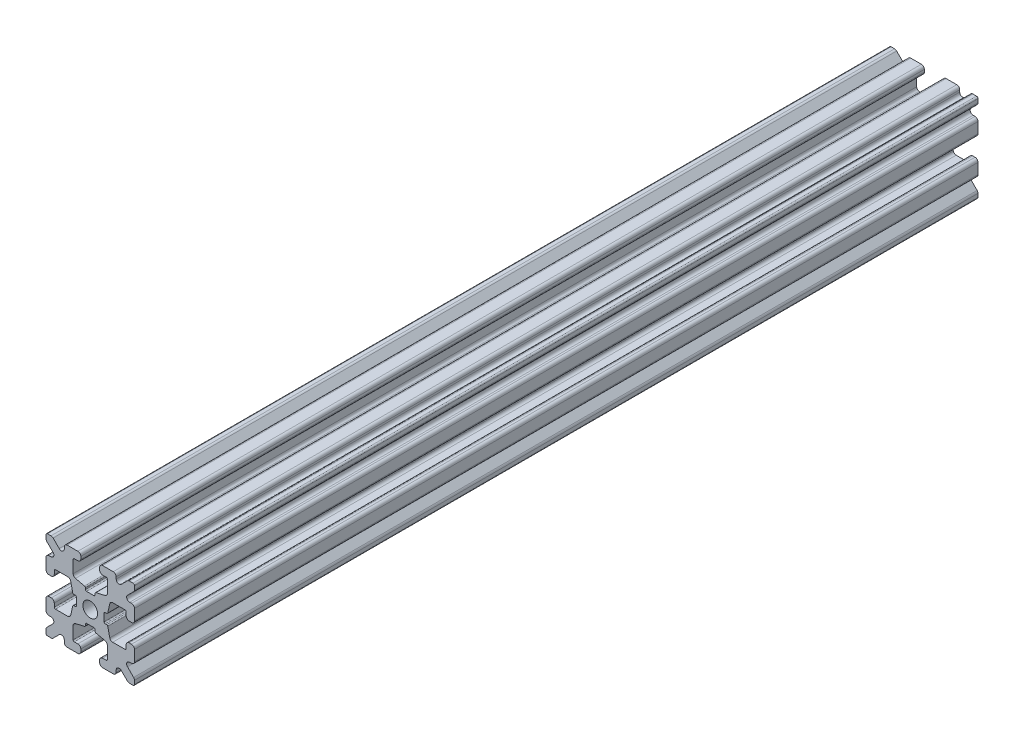
from build123d import *

# Parameters (mm, degrees)
SKETCH1_W           = 15
SKETCH1_H           = 15
SKETCH1_R           = 1.25
BOSS_EXTRUDE1_DEPTH = 71.5
FILLET1_R           = 0.25
CUT_EXTRUDE1_DEPTH  = 144.392817114
CUT_EXTRUDE3_DEPTH  = 144.392817114
FILLET3_R           = 0.5
FILLET4_R           = 0.5
FILLET5_R           = 3
FILLET6_R           = 0.2
CUT_EXTRUDE4_DEPTH  = 144.392817114
FILLET8_R           = 0.5
SKETCH6_W           = 5.1529354
SKETCH6_H           = 1.651
SKETCH6_W_2         = 1.651
SKETCH6_H_2         = 5.1529354
CUT_EXTRUDE5_DEPTH  = 144.392817114
FILLET10_R          = 0.2


with BuildPart() as part:
    # Sketch1 → Boss-Extrude1 (new, symmetric)
    with BuildSketch(Plane.XY):
        Rectangle(SKETCH1_W, SKETCH1_H)
        Circle(SKETCH1_R, mode=Mode.SUBTRACT)
    extrude(amount=BOSS_EXTRUDE1_DEPTH, both=True)

    # Fillet1
    fillet1_edges = [part.edges().sort_by_distance(p)[0] for p in [
        (7.5, -7.5, 0),
        (-7.5, -7.5, 0),
        (-7.5, 7.5, 0),
        (7.5, 7.5, 0),
    ]]
    fillet(fillet1_edges, radius=FILLET1_R)

    # Sketch2 → Cut-Extrude1 (cut, through all)
    with BuildSketch(Plane.XY.offset(71.5)):
        Polygon((-7.5, 1.6), (-6.1, 1.6), (-6.1, 2.9), (-3.4, 2.9), (-3.4, -2.9), (-6.1, -2.9), (-6.1, -1.6), (-7.5, -1.6), align=None)
        Polygon((2.9, 6.1), (1.6, 6.1), (1.6, 7.5), (-1.6, 7.5), (-1.6, 6.1), (-2.9, 6.1), (-2.9, 3.4), (2.9, 3.4), align=None)
        Polygon((-1.6, -7.5), (-1.6, -6.1), (-2.9, -6.1), (-2.9, -3.4), (2.9, -3.4), (2.9, -6.1), (1.6, -6.1), (1.6, -7.5), align=None)
        Polygon((6.1, -2.9), (6.1, -1.6), (7.5, -1.6), (7.5, 1.6), (6.1, 1.6), (6.1, 2.9), (3.4, 2.9), (3.4, -2.9), align=None)
    extrude(amount=-CUT_EXTRUDE1_DEPTH, mode=Mode.SUBTRACT)

    # Sketch4 → Cut-Extrude3 (cut, through all)
    with BuildSketch(Plane.XY.offset(71.5)):
        Polygon((-3.4, 2.9), (-2.75, 0), (-3.4, -2.9), align=None)
        Polygon((-2.9, 3.4), (0, 2.75), (2.9, 3.4), align=None)
        Polygon((3.4, 2.9), (2.75, 0), (3.4, -2.9), align=None)
        Polygon((-2.9, -3.4), (0, -2.75), (2.9, -3.4), align=None)
    extrude(amount=-CUT_EXTRUDE3_DEPTH, mode=Mode.SUBTRACT)

    # Fillet3
    fillet3_edges = [part.edges().sort_by_distance(p)[0] for p in [
        (1.6, -7.5, 0),
        (-1.6, -7.5, 0),
        (-1.6, -6.1, 0),
        (1.6, -6.1, 0),
        (6.1, 1.6, 0),
        (7.5, 1.6, 0),
        (7.5, -1.6, 0),
        (6.1, -1.6, 0),
        (-7.5, -1.6, 0),
        (-7.5, 1.6, 0),
        (-6.1, 1.6, 0),
        (-6.1, -1.6, 0),
        (-1.6, 6.1, 0),
        (-1.6, 7.5, 0),
        (1.6, 7.5, 0),
        (1.6, 6.1, 0),
    ]]
    fillet(fillet3_edges, radius=FILLET3_R)

    # Fillet4
    fillet4_edges = [part.edges().sort_by_distance(p)[0] for p in [
        (-2.9, -3.4, 0),
        (2.9, -3.4, 0),
        (3.4, -2.9, 0),
        (3.4, 2.9, 0),
        (-3.4, 2.9, 0),
        (-3.4, -2.9, 0),
        (2.9, 3.4, 0),
        (-2.9, 3.4, 0),
    ]]
    fillet(fillet4_edges, radius=FILLET4_R)

    # Fillet5
    fillet5_edges = [part.edges().sort_by_distance(p)[0] for p in [
        (-2.75, 0, 0),
        (0, 2.75, 0),
        (2.75, 0, 0),
        (0, -2.75, 0),
    ]]
    fillet(fillet5_edges, radius=FILLET5_R)

    # Fillet6
    fillet6_edges = [part.edges().sort_by_distance(p)[0] for p in [
        (-2.9, -6.1, 0),
        (2.9, -6.1, 0),
        (6.1, -2.9, 0),
        (6.1, 2.9, 0),
        (-6.1, 2.9, 0),
        (-6.1, -2.9, 0),
        (2.9, 6.1, 0),
        (-2.9, 6.1, 0),
    ]]
    fillet(fillet6_edges, radius=FILLET6_R)

    # Sketch5 → Cut-Extrude4 (cut, through all)
    with BuildSketch(Plane.XY.offset(71.5)):
        Polygon((-7.5, 6.439339828), (-5.460660172, 4.4), (-7.5, 4.4), align=None)
        Polygon((-6.439339828, 7.5), (-4.4, 5.460660172), (-4.4, 7.5), align=None)
        Polygon((4.4, 7.5), (6.439339828, 7.5), (4.4, 5.460660172), align=None)
        Polygon((7.5, 6.439339828), (7.5, 4.4), (5.460660172, 4.4), align=None)
        Polygon((7.5, -6.439339828), (5.460660172, -4.4), (7.5, -4.4), align=None)
        Polygon((6.439339828, -7.5), (4.4, -5.460660172), (4.4, -7.5), align=None)
        Polygon((-4.4, -7.5), (-6.439339828, -7.5), (-4.4, -5.460660172), align=None)
        Polygon((-7.5, -6.439339828), (-7.5, -4.4), (-5.460660172, -4.4), align=None)
    extrude(amount=-CUT_EXTRUDE4_DEPTH, mode=Mode.SUBTRACT)

    # Fillet8
    fillet8_edges = [part.edges().sort_by_distance(p)[0] for p in [
        (-7.5, 4.4, 0),
        (-7.5, 6.439339828, 0),
        (-5.460660172, 4.4, 0),
        (7.5, -4.4, 0),
        (7.5, -6.439339828, 0),
        (5.460660172, -4.4, 0),
        (5.460660172, 4.4, 0),
        (7.5, 6.439339828, 0),
        (7.5, 4.4, 0),
        (-4.4, 7.5, 0),
        (-4.4, 5.460660172, 0),
        (-6.439339828, 7.5, 0),
        (-5.460660172, -4.4, 0),
        (-7.5, -6.439339828, 0),
        (-7.5, -4.4, 0),
        (4.4, 5.460660172, 0),
        (4.4, 7.5, 0),
        (6.439339828, 7.5, 0),
        (6.439339828, -7.5, 0),
        (4.4, -7.5, 0),
        (4.4, -5.460660172, 0),
        (-6.439339828, -7.5, 0),
        (-4.4, -5.460660172, 0),
        (-4.4, -7.5, 0),
    ]]
    fillet(fillet8_edges, radius=FILLET8_R)

    # Sketch6 → Cut-Extrude5 (cut, through all)
    with BuildSketch(Plane.XY.offset(71.5)):
        with Locations((4.9235323, 0)):
            Rectangle(SKETCH6_W, SKETCH6_H)
        with Locations((0, -4.9235323)):
            Rectangle(SKETCH6_W_2, SKETCH6_H_2)
        with Locations((-4.9235323, 0)):
            Rectangle(SKETCH6_W, SKETCH6_H)
        with Locations((0, 4.9235323)):
            Rectangle(SKETCH6_W_2, SKETCH6_H_2)
    extrude(amount=-CUT_EXTRUDE5_DEPTH, mode=Mode.SUBTRACT)

    # Fillet10
    fillet10_edges = [part.edges().sort_by_distance(p)[0] for p in [
        (0.8255, -2.935025862, 0),
        (-0.8255, -2.935025862, 0),
        (0.8255, -2.3470646, 0),
        (-0.8255, -2.3470646, 0),
        (2.935025862, 0.8255, 0),
        (2.935025862, -0.8255, 0),
        (2.3470646, 0.8255, 0),
        (2.3470646, -0.8255, 0),
        (-2.935025862, -0.8255, 0),
        (-2.935025862, 0.8255, 0),
        (-2.3470646, -0.8255, 0),
        (-2.3470646, 0.8255, 0),
        (-0.8255, 2.935025862, 0),
        (0.8255, 2.935025862, 0),
        (-0.8255, 2.3470646, 0),
        (0.8255, 2.3470646, 0),
    ]]
    fillet(fillet10_edges, radius=FILLET10_R)


solid = part.part
